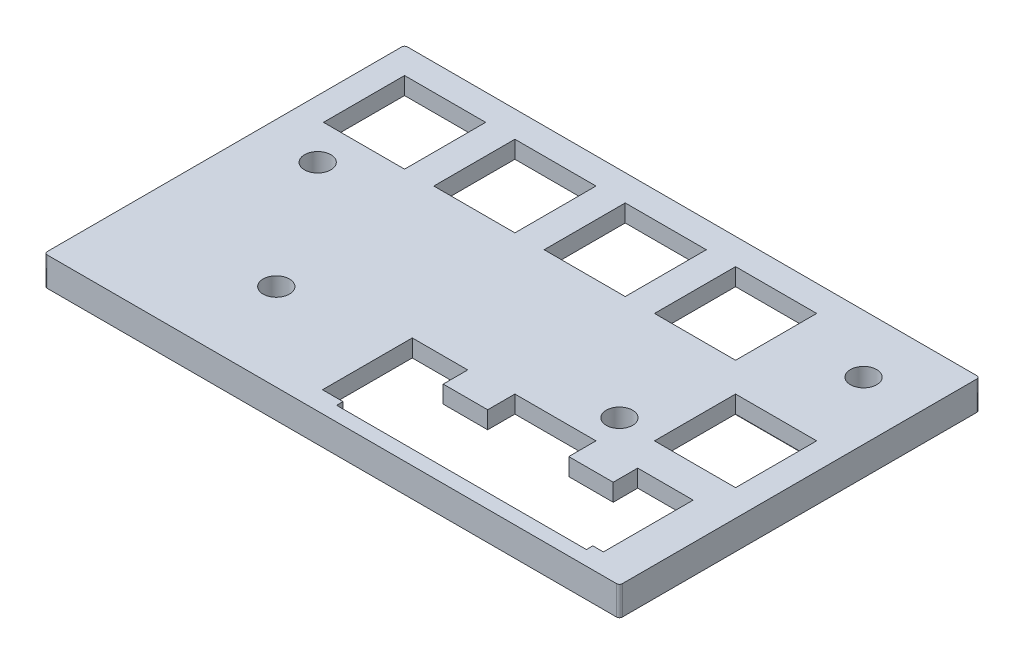
from build123d import *

# Parameters (mm, degrees)
SKETCH1_W           = 99.3
SKETCH1_H           = 62.2
SKETCH1_R           = 2.275
SKETCH1_W_2         = 14
SKETCH1_H_2         = 14
BOSS_EXTRUDE1_DEPTH = 3
SKETCH6_W           = 99.3
SKETCH6_H           = 62.2
SKETCH6_W_2         = 75.15
SKETCH6_H_2         = 18
SKETCH6_R           = 2.275
BOSS_EXTRUDE2_DEPTH = 2
FILLET1_R           = 0.5


with BuildPart() as part:
    # Sketch1 → Boss-Extrude1 (new body)
    with BuildSketch(Plane(origin=(0, 0, 0), x_dir=(1, 0, 0), z_dir=(0, 1, 0))):
        with Locations((49.65, 31.1)):
            Rectangle(SKETCH1_W, SKETCH1_H)
        with Locations(Location((10, 37.2, 0), (0, 0, 270))):
            Circle(SKETCH1_R, mode=Mode.SUBTRACT)
        with Locations(Location((89.25, 52.2, 0), (0, 0, 270))):
            Circle(SKETCH1_R, mode=Mode.SUBTRACT)
        with Locations(Location((74.25, 25.05, 0), (0, 0, 270))):
            Circle(SKETCH1_R, mode=Mode.SUBTRACT)
        with Locations(Location((25, 15.05, 0), (0, 0, 270))):
            Circle(SKETCH1_R, mode=Mode.SUBTRACT)
        with Locations((11.525, 50.675)):
            Rectangle(SKETCH1_W_2, SKETCH1_H_2, mode=Mode.SUBTRACT)
        with Locations((30.575, 50.675)):
            Rectangle(SKETCH1_W_2, SKETCH1_H_2, mode=Mode.SUBTRACT)
        with Locations((49.625, 50.675)):
            Rectangle(SKETCH1_W_2, SKETCH1_H_2, mode=Mode.SUBTRACT)
        with Locations((68.675, 50.675)):
            Rectangle(SKETCH1_W_2, SKETCH1_H_2, mode=Mode.SUBTRACT)
        with Locations((87.725, 31.625)):
            Rectangle(SKETCH1_W_2, SKETCH1_H_2, mode=Mode.SUBTRACT)
        Polygon((61.675, 19.575), (75.675, 19.575), (75.675, 14.875), (83.35, 14.875), (83.35, 19.105), (92.925, 19.105), (92.925, 3.605), (91.1, 3.605), (91.1, 2.5), (47.975, 2.5), (47.975, 3.605), (44.425, 3.605), (44.425, 19.105), (54, 19.105), (54, 14.875), (61.675, 14.875), align=None, mode=Mode.SUBTRACT)
    extrude(amount=-BOSS_EXTRUDE1_DEPTH)

    # Sketch6 → Boss-Extrude2 (add)
    with BuildSketch(Plane.XZ.offset(3)):
        with Locations((49.65, -31.1)):
            Rectangle(SKETCH6_W, SKETCH6_H)
        with Locations((40.1, -50.675)):
            Rectangle(SKETCH6_W_2, SKETCH6_H_2, mode=Mode.SUBTRACT)
        with Locations(Location((10, -37.2, 0), (0, 0, 90))):
            Circle(SKETCH6_R, mode=Mode.SUBTRACT)
        with Locations(Location((89.25, -52.2, 0), (0, 0, 90))):
            Circle(SKETCH6_R, mode=Mode.SUBTRACT)
        with Locations(Location((25, -15.05, 0), (0, 0, 90))):
            Circle(SKETCH6_R, mode=Mode.SUBTRACT)
        with Locations(Location((74.25, -25.05, 0), (0, 0, 90))):
            Circle(SKETCH6_R, mode=Mode.SUBTRACT)
        Polygon((96.725, -2.5), (96.725, -40.562928412), (78.725, -40.562928412), (78.725, -21.575), (40.625, -21.575), (40.625, -2.5), (47.975, -2.5), (91.1, -2.5), align=None, mode=Mode.SUBTRACT)
    extrude(amount=BOSS_EXTRUDE2_DEPTH)

    # Fillet1
    fillet1_edges = [part.edges().sort_by_distance(p)[0] for p in [
        (0, -2.5, 0),
        (0, -2.5, -62.2),
        (99.3, -2.5, -62.2),
        (99.3, -2.5, 0),
    ]]
    fillet(fillet1_edges, radius=FILLET1_R)


solid = part.part
